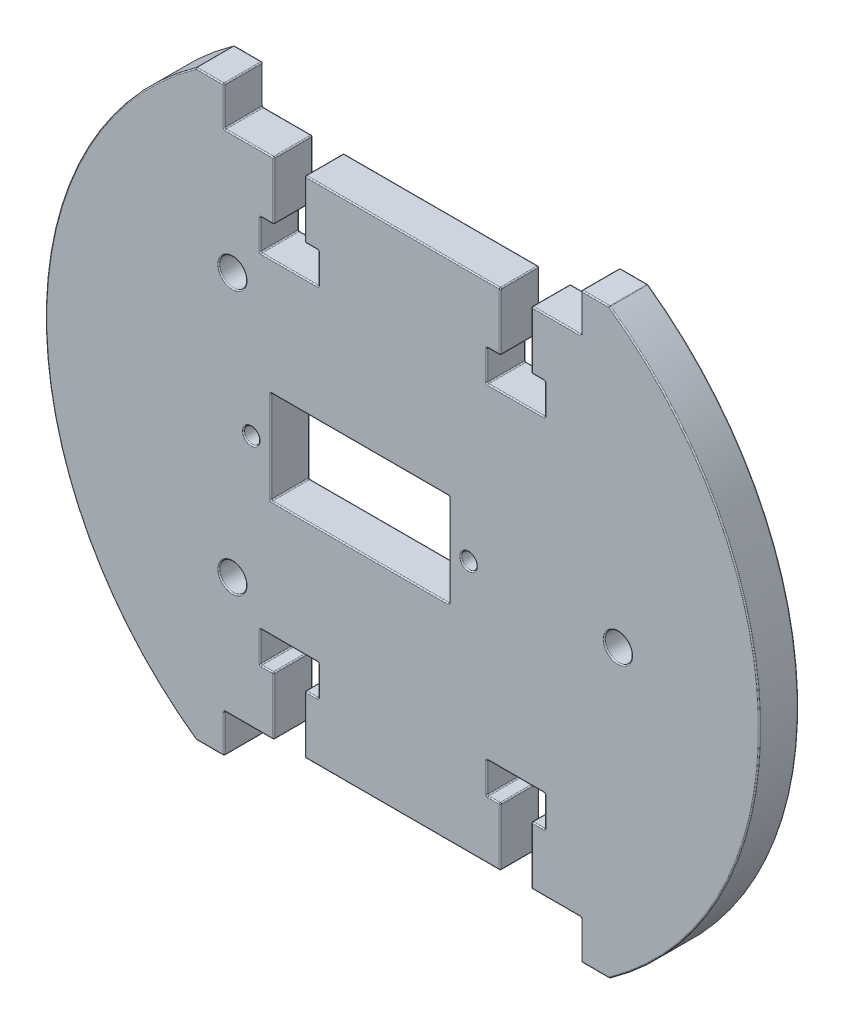
from build123d import *

# Parameters (mm, degrees)
SKETCH1_R           = 1
SKETCH1_R_2         = 1.75
SKETCH1_W           = 23
SKETCH1_H           = 12
BOSS_EXTRUDE1_DEPTH = 5
CUT_EXTRUDE1_DEPTH  = 5
FILLET1_R           = 0.15


with BuildPart() as part:
    # Sketch1 → Boss-Extrude1 (new body)
    with BuildSketch(Plane.XY):
        with BuildLine():
            Line((-26.64113361, 37.5), (-23, 37.5))
            Line((-23, 37.5), (-23, 32.5))
            Line((-23, 32.5), (23, 32.5))
            Line((23, 32.5), (23, 37.5))
            Line((23, 37.5), (26.64113361, 37.5))
            ThreePointArc((26.64113361, 37.5), (46, 0), (26.64113361, -37.5))
            Line((26.64113361, -37.5), (23, -37.5))
            Line((23, -37.5), (23, -32.5))
            Line((23, -32.5), (-23, -32.5))
            Line((-23, -32.5), (-23, -37.5))
            Line((-23, -37.5), (-26.64113361, -37.5))
            ThreePointArc((-26.64113361, -37.5), (-46, 0), (-26.64113361, 37.5))
        make_face()
        with Locations((8.5, 0)):
            Circle(SKETCH1_R, mode=Mode.SUBTRACT)
        with Locations(Location((-19.5, 0, 0), (0, 0, 180))):
            Circle(SKETCH1_R, mode=Mode.SUBTRACT)
        with Locations((-21.93, 17)):
            Circle(SKETCH1_R_2, mode=Mode.SUBTRACT)
        with Locations((-21.93, -17)):
            Circle(SKETCH1_R_2, mode=Mode.SUBTRACT)
        with Locations((27.75, 0)):
            Circle(SKETCH1_R_2, mode=Mode.SUBTRACT)
        with Locations((-5.5, 0)):
            Rectangle(SKETCH1_W, SKETCH1_H, mode=Mode.SUBTRACT)
    extrude(amount=BOSS_EXTRUDE1_DEPTH)

    # Sketch2 → Cut-Extrude1 (cut)
    with BuildSketch(Plane.XY.offset(5)):
        Polygon((-10.85, 25), (-12.6, 25), (-12.6, 32.5), (-16.6, 32.5), (-16.6, 25), (-18.35, 25), (-18.35, 21), (-10.85, 21), align=None)
        Polygon((10.85, 21), (18.35, 21), (18.35, 25), (16.6, 25), (16.6, 32.5), (12.6, 32.5), (12.6, 25), (10.85, 25), align=None)
        Polygon((10.85, -25), (12.6, -25), (12.6, -32.5), (16.6, -32.5), (16.6, -25), (18.35, -25), (18.35, -21), (10.85, -21), align=None)
        Polygon((-10.85, -21), (-18.35, -21), (-18.35, -25), (-16.6, -25), (-16.6, -32.5), (-12.6, -32.5), (-12.6, -25), (-10.85, -25), align=None)
    extrude(amount=-CUT_EXTRUDE1_DEPTH, mode=Mode.SUBTRACT)

    # Fillet1
    fillet1_edges = [part.edges().sort_by_distance(p)[0] for p in [
        (-12.6, -28.75, 5),
        (-12.6, -25, 2.5),
        (-12.6, -32.5, 2.5),
        (-16.6, -28.75, 0),
        (-16.6, -32.5, 2.5),
        (-12.6, -28.75, 0),
        (-17.475, -25, 0),
        (-10.85, -23, 0),
        (-11.725, -25, 0),
        (-14.6, -21, 5),
        (-18.35, -23, 5),
        (-16.6, -28.75, 5),
        (-14.6, -21, 0),
        (-18.35, -21, 2.5),
        (-10.85, -23, 5),
        (-10.85, -21, 2.5),
        (-18.35, -23, 0),
        (-18.35, -25, 2.5),
        (-16.6, -25, 2.5),
        (-17.475, -25, 5),
        (-10.85, -25, 2.5),
        (-11.725, -25, 5),
        (18.35, -23, 5),
        (18.35, -21, 2.5),
        (17.475, -25, 0),
        (18.35, -25, 2.5),
        (16.6, -28.75, 5),
        (16.6, -25, 2.5),
        (16.6, -32.5, 2.5),
        (12.6, -28.75, 0),
        (12.6, -32.5, 2.5),
        (11.725, -25, 0),
        (12.6, -25, 2.5),
        (10.85, -23, 0),
        (10.85, -25, 2.5),
        (14.6, -21, 5),
        (10.85, -21, 2.5),
        (18.35, -23, 0),
        (16.6, -28.75, 0),
        (14.6, -21, 0),
        (10.85, -23, 5),
        (11.725, -25, 5),
        (12.6, -28.75, 5),
        (17.475, -25, 5),
        (-19.8, -32.5, 0),
        (-23, -35, 0),
        (12.6, 28.75, 5),
        (12.6, 25, 2.5),
        (12.6, 32.5, 2.5),
        (16.6, 28.75, 0),
        (16.6, 32.5, 2.5),
        (17.475, 25, 5),
        (16.6, 25, 2.5),
        (18.35, 23, 0),
        (18.35, 25, 2.5),
        (46, 0, 5),
        (-24.820566805, -37.5, 0),
        (14.6, 21, 0),
        (18.35, 21, 2.5),
        (10.85, 23, 5),
        (10.85, 21, 2.5),
        (11.725, 25, 5),
        (10.85, 25, 2.5),
        (12.6, 28.75, 0),
        (17.475, 25, 0),
        (10.85, 23, 0),
        (11.725, 25, 0),
        (14.6, 21, 5),
        (18.35, 23, 5),
        (16.6, 28.75, 5),
        (-46, 0, 0),
        (-24.820566805, 37.5, 0),
        (-18.35, 23, 5),
        (-18.35, 21, 2.5),
        (-17.475, 25, 0),
        (-18.35, 25, 2.5),
        (-16.6, 28.75, 5),
        (-16.6, 25, 2.5),
        (-16.6, 32.5, 2.5),
        (-12.6, 28.75, 0),
        (-23, 35, 0),
        (-12.6, 32.5, 2.5),
        (-11.725, 25, 0),
        (-12.6, 25, 2.5),
        (-10.85, 23, 0),
        (-10.85, 25, 2.5),
        (-14.6, 21, 5),
        (-10.85, 21, 2.5),
        (-18.35, 23, 0),
        (-16.6, 28.75, 0),
        (-14.6, 21, 0),
        (-10.85, 23, 5),
        (-11.725, 25, 5),
        (-12.6, 28.75, 5),
        (-17.475, 25, 5),
        (19.8, 32.5, 0),
        (23, 35, 0),
        (24.820566805, 37.5, 0),
        (46, 0, 0),
        (24.820566805, -37.5, 0),
        (23, -35, 0),
        (24.820566805, 37.5, 5),
        (23, -32.5, 2.5),
        (-23, -32.5, 2.5),
        (-23, -37.5, 2.5),
        (23, 35, 5),
        (-26.64113361, -37.5, 2.5),
        (-26.64113361, 37.5, 2.5),
        (-23, 37.5, 2.5),
        (-23, 32.5, 2.5),
        (23, 32.5, 2.5),
        (23, 37.5, 2.5),
        (26.64113361, 37.5, 2.5),
        (26.64113361, -37.5, 2.5),
        (23, -37.5, 2.5),
        (19.8, 32.5, 5),
        (-23, 35, 5),
        (-24.820566805, 37.5, 5),
        (-17, 0, 0),
        (-17, 6, 2.5),
        (-5.5, -6, 0),
        (-17, -6, 2.5),
        (6, 0, 0),
        (6, -6, 2.5),
        (-5.5, 6, 0),
        (6, 6, 2.5),
        (-17, 0, 5),
        (-5.5, -6, 5),
        (6, 0, 5),
        (-5.5, 6, 5),
        (-46, 0, 5),
        (-24.820566805, -37.5, 5),
        (7.5, 0, 0),
        (7.5, 0, 5),
        (-23, -35, 5),
        (-18.5, 0, 0),
        (-18.5, 0, 5),
        (-19.8, -32.5, 5),
        (23, -35, 5),
        (-23.68, -17, 0),
        (-23.68, -17, 5),
        (26, 0, 0),
        (26, 0, 5),
        (-23.68, 17, 0),
        (-23.68, 17, 5),
        (0, -32.5, 0),
        (19.8, -32.5, 0),
        (0, -32.5, 5),
        (19.8, -32.5, 5),
        (0, 32.5, 0),
        (-19.8, 32.5, 0),
        (0, 32.5, 5),
        (-19.8, 32.5, 5),
        (24.820566805, -37.5, 5),
    ]]
    fillet(fillet1_edges, radius=FILLET1_R)


solid = part.part
